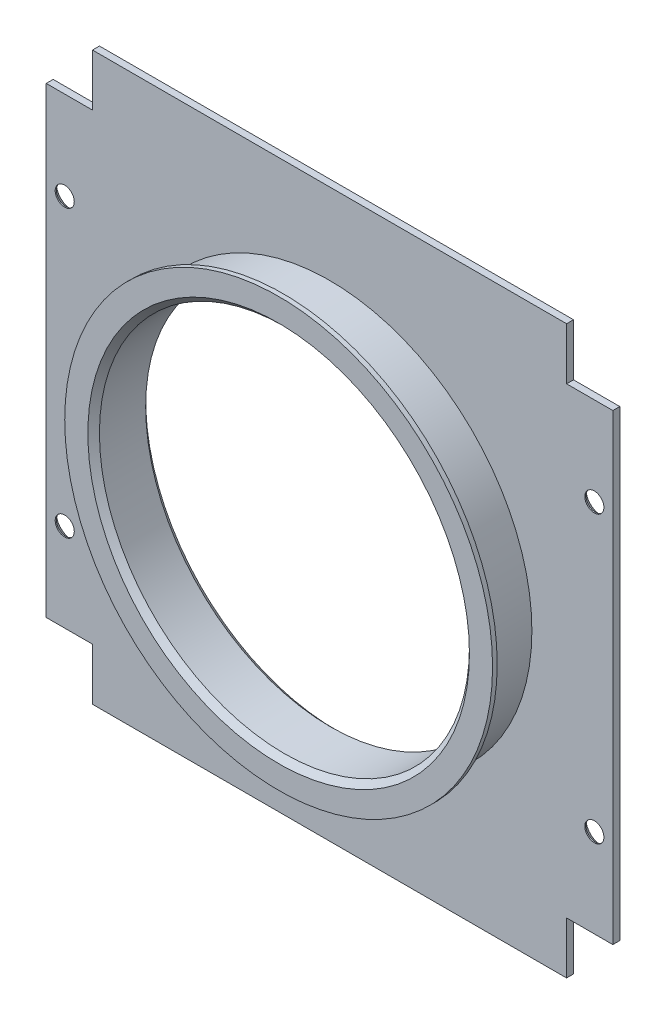
from build123d import *

# Parameters (mm, degrees)
BOSS_EXTRUDE1_DEPTH = 1.2
SKETCH2_R           = 1.65
CUT_EXTRUDE1_DEPTH  = 1.2
SKETCH3_R           = 35
BOSS_EXTRUDE2_DEPTH = 8
SKETCH5_R           = 37
BOSS_EXTRUDE3_DEPTH = 0.8
SKETCH6_R           = 32
CUT_EXTRUDE2_DEPTH  = 139.953229541
CHAMFER1_SIZE       = 1
CHAMFER2_SIZE       = 1


with BuildPart() as part:
    # Sketch1 → Boss-Extrude1 (new body)
    with BuildSketch(Plane(origin=(0, 0, 0), x_dir=(0, 1, 0), z_dir=(0, 0, 1))):
        Polygon((0, 8), (9, 8), (9, 0), (89, 0), (89, 8), (98, 8), (98, 90), (89, 90), (89, 98), (9, 98), (9, 90), (0, 90), align=None)
    extrude(amount=BOSS_EXTRUDE1_DEPTH)

    # Sketch2 → Cut-Extrude1 (cut)
    with BuildSketch(Plane.XY.offset(1.2)):
        with Locations((-94.8, 73.7)):
            Circle(SKETCH2_R)
        with Locations((-94.8, 24.3)):
            Circle(SKETCH2_R)
        with Locations((-3.2, 24.3)):
            Circle(SKETCH2_R)
        with Locations((-3.2, 73.7)):
            Circle(SKETCH2_R)
    extrude(amount=-CUT_EXTRUDE1_DEPTH, mode=Mode.SUBTRACT)

    # Sketch3 → Boss-Extrude2 (add)
    with BuildSketch(Plane.XY.offset(1.2)):
        with Locations((-49, 49)):
            Circle(SKETCH3_R)
    extrude(amount=BOSS_EXTRUDE2_DEPTH)

    # Sketch5 → Boss-Extrude3 (add)
    with BuildSketch(Plane.XY.offset(9.2)):
        with Locations((-49, 49)):
            Circle(SKETCH5_R)
    extrude(amount=BOSS_EXTRUDE3_DEPTH)

    # Sketch6 → Cut-Extrude2 (cut, through all)
    with BuildSketch(Plane.XY.offset(10)):
        with Locations((-49, 49)):
            Circle(SKETCH6_R)
    extrude(amount=-CUT_EXTRUDE2_DEPTH, mode=Mode.SUBTRACT)

    # Chamfer1
    chamfer1_edges = [part.edges().sort_by_distance(p)[0] for p in [
        (-4.85, 73.7, 0),
        (-4.85, 24.3, 0),
        (-96.45, 24.3, 0),
        (-96.45, 73.7, 0),
    ]]
    chamfer(chamfer1_edges, length=CHAMFER1_SIZE)

    # Chamfer2
    chamfer2_edges = [part.edges().sort_by_distance(p)[0] for p in [
        (-81, 49, 0),
        (-81, 49, 10),
    ]]
    chamfer(chamfer2_edges, length=CHAMFER2_SIZE)


solid = part.part
